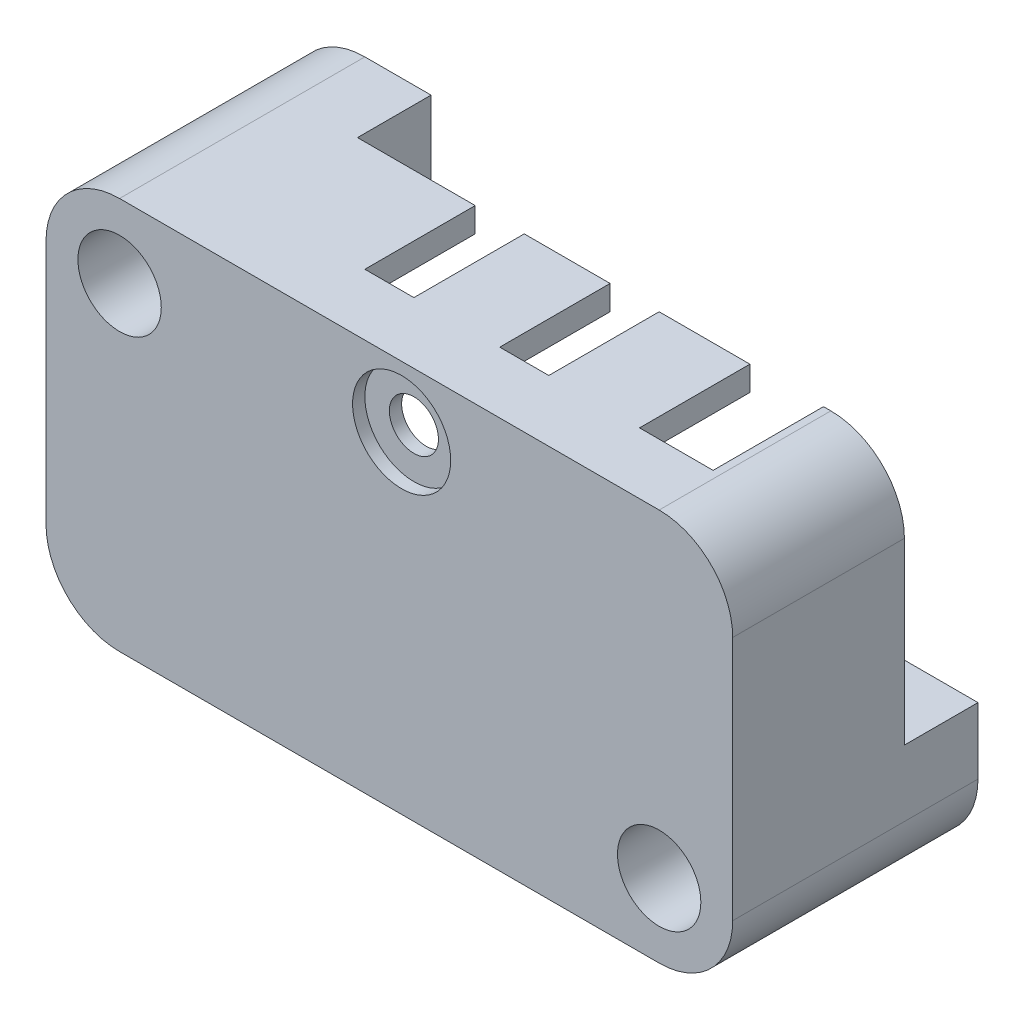
from build123d import *

# Parameters (mm, degrees)
SZKIC1_W                        = 28
SZKIC1_H                        = 16
DODANIE_WYCI_GNI_CIE1_DEPTH     = 10
WYTNIJ_WYCI_GNI_CIE1_REACH      = 20.974
SZKIC2_R                        = 1.7
ZAOKR_GLENIE1_R                 = 3
WYTNIJ_WYCI_GNI_CIE2_DEPTH      = 4
WYTNIJ_WYCI_GNI_CIE2_DEPTH_BACK = 4
WYTNIJ_WYCI_GNI_CIE3_DEPTH      = 3
WYTNIJ_WYCI_GNI_CIE4_REACH      = 25.495
SZKIC5_W                        = 2
SZKIC5_H                        = 4.5
SZKIC5_W_2                      = 3
SZKIC6_R                        = 2
WYTNIJ_WYCI_GNI_CIE5_DEPTH      = 0.5
WYTNIJ_WYCI_GNI_CIE6_REACH      = 20.715
SZKIC7_R                        = 1
WYTNIJ_WYCI_GNI_CIE7_REACH      = 32.79
SZKIC8_W                        = 5
SZKIC8_H                        = 1
WYTNIJ_WYCI_GNI_CIE8_REACH      = 25.495
SZKIC9_W                        = 1
SZKIC9_H                        = 5


with BuildPart() as part:
    # Szkic1 → Dodanie-wyciągnięcie1 (new body)
    with BuildSketch(Plane.XY):
        Rectangle(SZKIC1_W, SZKIC1_H)
    extrude(amount=DODANIE_WYCI_GNI_CIE1_DEPTH)

    # Szkic2 → Wytnij-wyciągnięcie1 (cut, up to next)
    with BuildSketch(Plane.XY.offset(10), mode=Mode.PRIVATE) as wytnij_wyci_gni_cie1_sk1:
        with Locations((-11, 5)):
            Circle(SZKIC2_R)
    wytnij_wyci_gni_cie1_tool1 = extrude(wytnij_wyci_gni_cie1_sk1.sketch, amount=-WYTNIJ_WYCI_GNI_CIE1_REACH, mode=Mode.PRIVATE) & part.part
    # Szkic2 → Wytnij-wyciągnięcie1 (cut, up to next)
    with BuildSketch(Plane.XY.offset(10), mode=Mode.PRIVATE) as wytnij_wyci_gni_cie1_sk2:
        with Locations((11, -5)):
            Circle(SZKIC2_R)
    wytnij_wyci_gni_cie1_tool2 = extrude(wytnij_wyci_gni_cie1_sk2.sketch, amount=-WYTNIJ_WYCI_GNI_CIE1_REACH, mode=Mode.PRIVATE) & part.part
    add(wytnij_wyci_gni_cie1_tool1.solids().sort_by_distance((-11, 5, 10))[0], mode=Mode.SUBTRACT)
    add(wytnij_wyci_gni_cie1_tool2.solids().sort_by_distance((11, -5, 10))[0], mode=Mode.SUBTRACT)

    # Zaokrąglenie1
    zaokr_glenie1_edges = [part.edges().sort_by_distance(p)[0] for p in [
        (14, -8, 5),
        (-14, -8, 5),
        (-14, 8, 5),
        (14, 8, 5),
    ]]
    fillet(zaokr_glenie1_edges, radius=ZAOKR_GLENIE1_R)

    # Szkic3 → Wytnij-wyciągnięcie2 (cut, two sides: drawn at the far end of the back side and taken through both)
    with BuildSketch(Plane.XY.offset(5).offset(-WYTNIJ_WYCI_GNI_CIE2_DEPTH_BACK)):
        with BuildLine():
            Line((11, 7), (-7.3, 7))
            ThreePointArc((-7.3, 7), (-8.007106781, 6.707106781), (-8.3, 6))
            Line((-8.3, 6), (-8.3, 5))
            ThreePointArc((-8.3, 5), (-9.090811691, 3.090811691), (-11, 2.3))
            Line((-11, 2.3), (-12, 2.3))
            ThreePointArc((-12, 2.3), (-12.707106781, 2.007106781), (-13, 1.3))
            Line((-13, 1.3), (-13, -5))
            ThreePointArc((-13, -5), (-12.414213562, -6.414213562), (-11, -7))
            Line((-11, -7), (7.3, -7))
            ThreePointArc((7.3, -7), (8.007106781, -6.707106781), (8.3, -6))
            Line((8.3, -6), (8.3, -5))
            ThreePointArc((8.3, -5), (9.090811691, -3.090811691), (11, -2.3))
            Line((11, -2.3), (12, -2.3))
            ThreePointArc((12, -2.3), (12.707106781, -2.007106781), (13, -1.3))
            Line((13, -1.3), (13, 5))
            ThreePointArc((13, 5), (12.414213562, 6.414213562), (11, 7))
        make_face()
    extrude(amount=WYTNIJ_WYCI_GNI_CIE2_DEPTH + WYTNIJ_WYCI_GNI_CIE2_DEPTH_BACK, mode=Mode.SUBTRACT)

    # Szkic4 → Wytnij-wyciągnięcie3 (cut)
    with BuildSketch(Plane(origin=(0, 0, 0), x_dir=(-1, 0, 0), z_dir=(0, 0, -1))):
        with BuildLine():
            Line((-11, 8), (8.3, 8))
            Line((8.3, 8), (8.3, 5))
            ThreePointArc((8.3, 5), (9.090811691, 3.090811691), (11, 2.3))
            Line((11, 2.3), (14, 2.3))
            Line((14, 2.3), (14, -5))
            ThreePointArc((14, -5), (13.121320344, -7.121320344), (11, -8))
            Line((11, -8), (-8.3, -8))
            Line((-8.3, -8), (-8.3, -5))
            ThreePointArc((-8.3, -5), (-9.090811691, -3.090811691), (-11, -2.3))
            Line((-11, -2.3), (-14, -2.3))
            Line((-14, -2.3), (-14, 5))
            ThreePointArc((-14, 5), (-13.121320344, 7.121320344), (-11, 8))
        make_face()
    extrude(amount=-WYTNIJ_WYCI_GNI_CIE3_DEPTH, mode=Mode.SUBTRACT)

    # Szkic5 → Wytnij-wyciągnięcie4 (cut, up to next)
    with BuildSketch(Plane(origin=(0, 8, 0), x_dir=(1, 0, 0), z_dir=(0, 1, 0)), mode=Mode.PRIVATE) as wytnij_wyci_gni_cie4_sk1:
        with Locations((3, -5.25)):
            Rectangle(SZKIC5_W, SZKIC5_H)
    wytnij_wyci_gni_cie4_tool1 = extrude(wytnij_wyci_gni_cie4_sk1.sketch, amount=-WYTNIJ_WYCI_GNI_CIE4_REACH, mode=Mode.PRIVATE) & part.part
    # Szkic5 → Wytnij-wyciągnięcie4 (cut, up to next)
    with BuildSketch(Plane(origin=(0, 8, 0), x_dir=(1, 0, 0), z_dir=(0, 1, 0)), mode=Mode.PRIVATE) as wytnij_wyci_gni_cie4_sk2:
        with Locations((9.2, -5.25)):
            Rectangle(SZKIC5_W_2, SZKIC5_H)
    wytnij_wyci_gni_cie4_tool2 = extrude(wytnij_wyci_gni_cie4_sk2.sketch, amount=-WYTNIJ_WYCI_GNI_CIE4_REACH, mode=Mode.PRIVATE) & part.part
    # Szkic5 → Wytnij-wyciągnięcie4 (cut, up to next)
    with BuildSketch(Plane(origin=(0, 8, 0), x_dir=(1, 0, 0), z_dir=(0, 1, 0)), mode=Mode.PRIVATE) as wytnij_wyci_gni_cie4_sk3:
        with Locations((-2.5, -5.25)):
            Rectangle(SZKIC5_W, SZKIC5_H)
    wytnij_wyci_gni_cie4_tool3 = extrude(wytnij_wyci_gni_cie4_sk3.sketch, amount=-WYTNIJ_WYCI_GNI_CIE4_REACH, mode=Mode.PRIVATE) & part.part
    add(wytnij_wyci_gni_cie4_tool1.solids().sort_by_distance((3, 8, 5.25))[0], mode=Mode.SUBTRACT)
    add(wytnij_wyci_gni_cie4_tool2.solids().sort_by_distance((9.2, 8, 5.25))[0], mode=Mode.SUBTRACT)
    add(wytnij_wyci_gni_cie4_tool3.solids().sort_by_distance((-2.5, 8, 5.25))[0], mode=Mode.SUBTRACT)

    # Szkic6 → Wytnij-wyciągnięcie5 (cut)
    with BuildSketch(Plane.XY.offset(10)):
        with Locations((0.5, 5.5)):
            Circle(SZKIC6_R)
    extrude(amount=-WYTNIJ_WYCI_GNI_CIE5_DEPTH, mode=Mode.SUBTRACT)

    # Szkic7 → Wytnij-wyciągnięcie6 (cut, up to next)
    with BuildSketch(Plane.XY.offset(9.5), mode=Mode.PRIVATE) as wytnij_wyci_gni_cie6_sk1:
        with Locations((0.5, 5.5)):
            Circle(SZKIC7_R)
    wytnij_wyci_gni_cie6_tool1 = extrude(wytnij_wyci_gni_cie6_sk1.sketch, amount=-WYTNIJ_WYCI_GNI_CIE6_REACH, mode=Mode.PRIVATE) & part.part
    add(wytnij_wyci_gni_cie6_tool1.solids().sort_by_distance((0.5, 5.5, 9.5))[0], mode=Mode.SUBTRACT)

    # Szkic8 → Wytnij-wyciągnięcie7 (cut, up to next)
    with BuildSketch(Plane.ZY.offset(14), mode=Mode.PRIVATE) as wytnij_wyci_gni_cie7_sk1:
        with Locations((5.5, 1.6)):
            Rectangle(SZKIC8_W, SZKIC8_H)
    wytnij_wyci_gni_cie7_tool1 = extrude(wytnij_wyci_gni_cie7_sk1.sketch, amount=-WYTNIJ_WYCI_GNI_CIE7_REACH, mode=Mode.PRIVATE) & part.part
    # Szkic8 → Wytnij-wyciągnięcie7 (cut, up to next)
    with BuildSketch(Plane.ZY.offset(14), mode=Mode.PRIVATE) as wytnij_wyci_gni_cie7_sk2:
        with Locations((5.5, -3.8)):
            Rectangle(SZKIC8_W, SZKIC8_H)
    wytnij_wyci_gni_cie7_tool2 = extrude(wytnij_wyci_gni_cie7_sk2.sketch, amount=-WYTNIJ_WYCI_GNI_CIE7_REACH, mode=Mode.PRIVATE) & part.part
    add(wytnij_wyci_gni_cie7_tool1.solids().sort_by_distance((-14, 1.6, 5.5))[0], mode=Mode.SUBTRACT)
    add(wytnij_wyci_gni_cie7_tool2.solids().sort_by_distance((-14, -3.8, 5.5))[0], mode=Mode.SUBTRACT)

    # Szkic9 → Wytnij-wyciągnięcie8 (cut, up to next)
    with BuildSketch(Plane.XZ.offset(8), mode=Mode.PRIVATE) as wytnij_wyci_gni_cie8_sk1:
        with Locations((-2, 5.5)):
            Rectangle(SZKIC9_W, SZKIC9_H)
    wytnij_wyci_gni_cie8_tool1 = extrude(wytnij_wyci_gni_cie8_sk1.sketch, amount=-WYTNIJ_WYCI_GNI_CIE8_REACH, mode=Mode.PRIVATE) & part.part
    add(wytnij_wyci_gni_cie8_tool1.solids().sort_by_distance((-2, -8, 5.5))[0], mode=Mode.SUBTRACT)


solid = part.part
